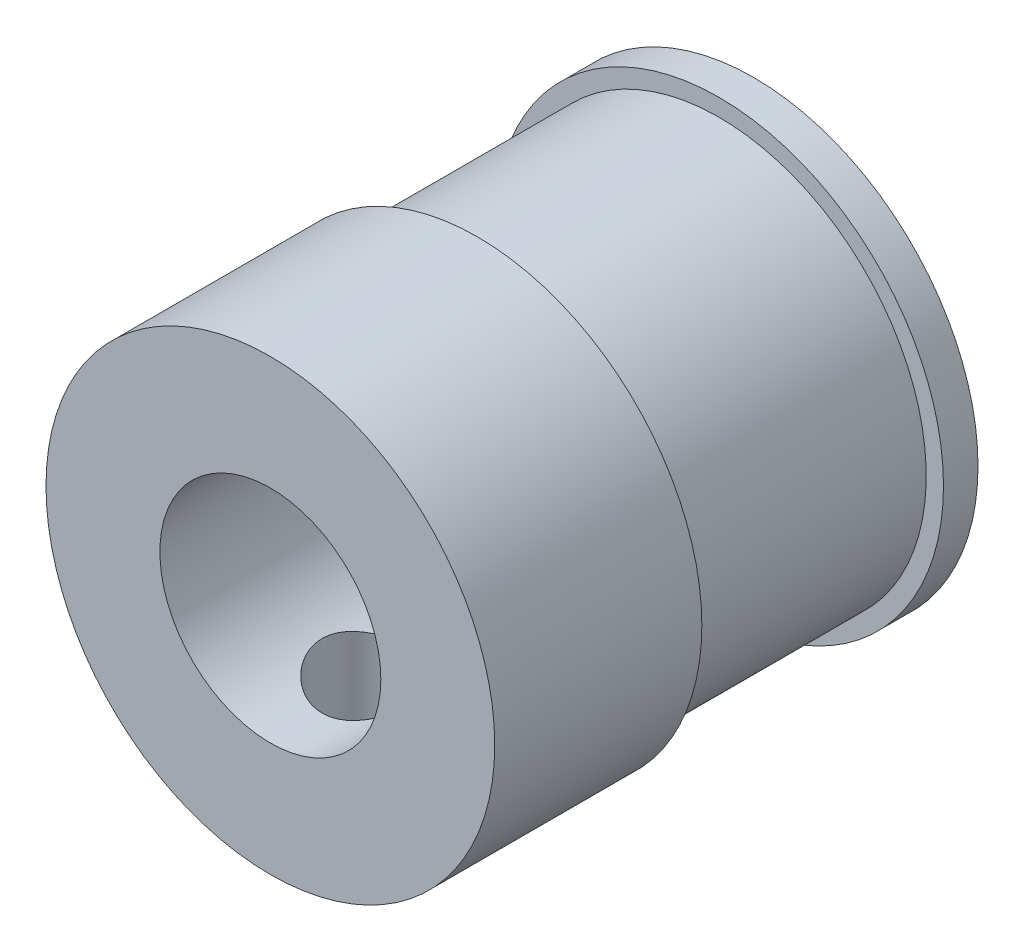
from build123d import *

# Parameters (mm, degrees)
SKETCH1_R           = 6.5
BOSS_EXTRUDE1_DEPTH = 14
SKETCH2_R           = 3.2
CUT_EXTRUDE1_DEPTH  = 17.748134224
SKETCH3_R           = 6.5
SKETCH3_R_2         = 6
CUT_EXTRUDE2_DEPTH  = 7
SKETCH4_R           = 1.5
CUT_EXTRUDE3_DEPTH  = 7


with BuildPart() as part:
    # Sketch1 → Boss-Extrude1 (new body)
    with BuildSketch(Plane.XY):
        Circle(SKETCH1_R)
    extrude(amount=BOSS_EXTRUDE1_DEPTH)

    # Sketch2 → Cut-Extrude1 (cut, through all)
    with BuildSketch(Plane.XY.offset(14)):
        Circle(SKETCH2_R)
    extrude(amount=-CUT_EXTRUDE1_DEPTH, mode=Mode.SUBTRACT)

    # Sketch3 → Cut-Extrude2 (cut)
    with BuildSketch(Plane(origin=(0, 0, 1), x_dir=(-1, 0, 0), z_dir=(0, 0, -1))):
        Circle(SKETCH3_R)
        Circle(SKETCH3_R_2, mode=Mode.SUBTRACT)
    extrude(amount=-CUT_EXTRUDE2_DEPTH, mode=Mode.SUBTRACT)

    # Sketch4 → Cut-Extrude3 (cut)
    with BuildSketch(Plane(origin=(0, 0, 0), x_dir=(1, 0, 0), z_dir=(0, 1, 0))):
        with Locations(Location((0, -11, 0), (0, 0, 270))):
            Circle(SKETCH4_R)
    extrude(amount=-CUT_EXTRUDE3_DEPTH, mode=Mode.SUBTRACT)


solid = part.part
